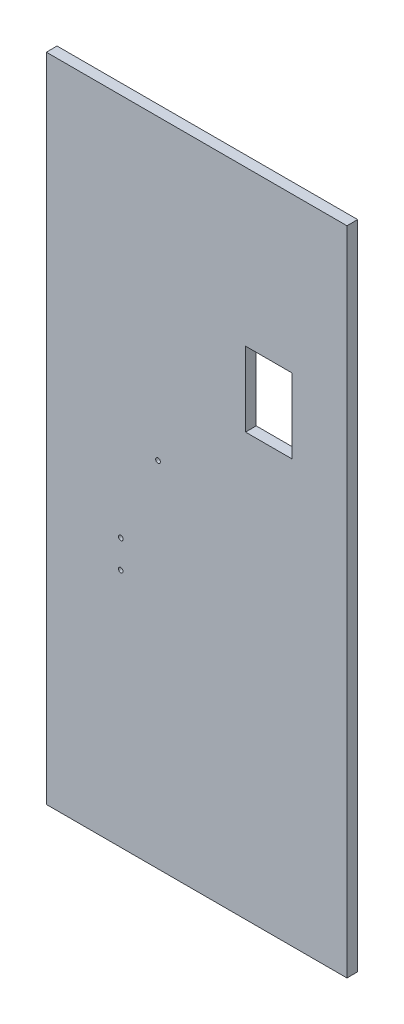
from build123d import *

# Parameters (mm, degrees)
SKETCH1_R           = 2.5
SKETCH1_W           = 50
SKETCH1_H           = 80
BOSS_EXTRUDE1_DEPTH = 11.5


with BuildPart() as part:
    # Sketch1 → Boss-Extrude1 (new body)
    with BuildSketch(Plane.XY):
        Polygon((-161.5, 350), (-161.5, -350), (-81.5, -350), (161.5, -350), (161.5, 350), align=None)
        with Locations((-41.5, 30)):
            Circle(SKETCH1_R, mode=Mode.SUBTRACT)
        with BuildLine():
            ThreePointArc((-81.5, -94.5), (-84, -92), (-81.5, -89.5))
            ThreePointArc((-81.5, -89.5), (-79, -92), (-81.5, -94.5))
        make_face(mode=Mode.SUBTRACT)
        with Locations((-81.5, -62)):
            Circle(SKETCH1_R, mode=Mode.SUBTRACT)
        with Locations((77.5, 143.5)):
            Rectangle(SKETCH1_W, SKETCH1_H, mode=Mode.SUBTRACT)
    extrude(amount=BOSS_EXTRUDE1_DEPTH)


solid = part.part
